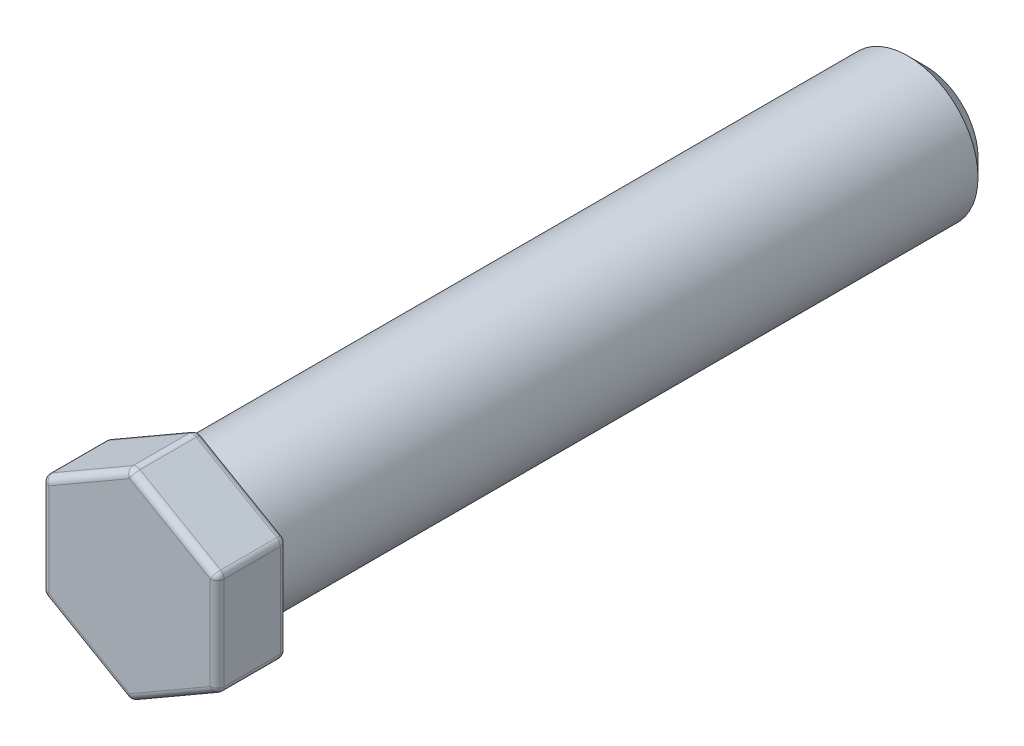
from build123d import *

# Parameters (mm, degrees)
SKETCH1_R           = 2
BOSS_EXTRUDE1_DEPTH = 20.7
BOSS_EXTRUDE2_DEPTH = 2
FILLET1_R           = 0.2
FILLET2_R           = 0.2
CHAMFER1_SIZE       = 0.5


with BuildPart() as part:
    # Sketch1 → Boss-Extrude1 (new body)
    with BuildSketch(Plane.XY):
        Circle(SKETCH1_R)
    extrude(amount=BOSS_EXTRUDE1_DEPTH)

    # Sketch2 → Boss-Extrude2 (add)
    with BuildSketch(Plane.XY.offset(20.7)):
        Polygon((2.5, -1.443375673), (2.5, 1.443375673), (0, 2.886751346), (-2.5, 1.443375673), (-2.5, -1.443375673), (0, -2.886751346), align=None)
    extrude(amount=BOSS_EXTRUDE2_DEPTH)

    # Fillet1
    fillet1_edges = [part.edges().sort_by_distance(p)[0] for p in [
        (-2, 0, 20.7),
        (1.25, -2.165063509, 20.7),
        (2.5, 0, 20.7),
        (1.25, 2.165063509, 20.7),
        (-1.25, 2.165063509, 20.7),
        (-2.5, 0, 20.7),
        (-1.25, -2.165063509, 20.7),
        (1.25, -2.165063509, 22.7),
        (2.5, 0, 22.7),
        (1.25, 2.165063509, 22.7),
        (-1.25, 2.165063509, 22.7),
        (-2.5, 0, 22.7),
        (-1.25, -2.165063509, 22.7),
    ]]
    fillet(fillet1_edges, radius=FILLET1_R)

    # Fillet2
    fillet2_edges = [part.edges().sort_by_distance(p)[0] for p in [
        (0, -2.886751346, 21.7),
        (-2.5, -1.443375673, 21.7),
        (-2.5, 1.443375673, 21.7),
        (0, 2.886751346, 21.7),
        (2.5, 1.443375673, 21.7),
        (2.5, -1.443375673, 21.7),
        (0, 2.813180543, 22.64637683),
        (2.436285816, 1.406590271, 22.64637683),
        (-2.436285816, 1.406590271, 22.64637683),
        (2.436285816, -1.406590271, 22.64637683),
        (-2.436285816, -1.406590271, 22.64637683),
        (0, -2.813180543, 22.64637683),
        (-2.436285816, -1.406590271, 20.75362317),
        (-2.436285816, 1.406590271, 20.75362317),
        (0, -2.813180464, 20.753623106),
        (0, 2.813180543, 20.75362317),
        (2.436285816, -1.406590271, 20.75362317),
        (2.436285816, 1.406590271, 20.75362317),
    ]]
    fillet(fillet2_edges, radius=FILLET2_R)

    # Chamfer1
    chamfer1_edges = [part.edges().sort_by_distance(p)[0] for p in [
        (-2, 0, 0),
    ]]
    chamfer(chamfer1_edges, length=CHAMFER1_SIZE)


solid = part.part
